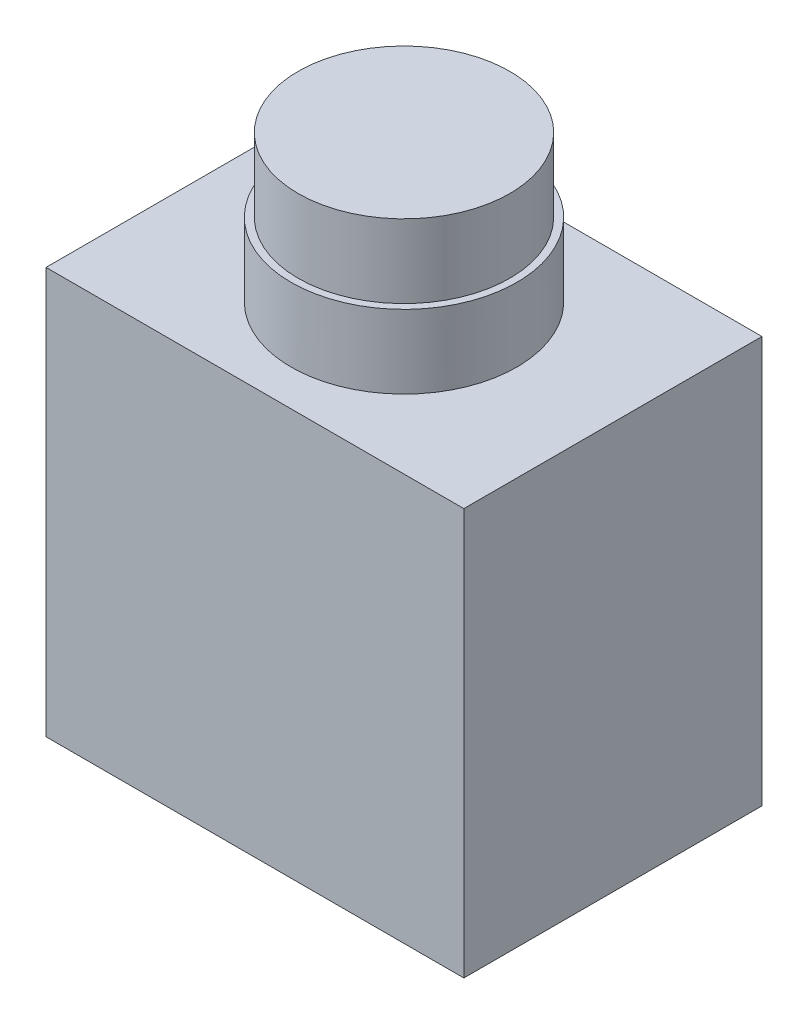
from build123d import *

# Parameters (mm, degrees)
SKETCH1_W           = 23.495
SKETCH1_H           = 16.764
BOSS_EXTRUDE1_DEPTH = 22.86
SKETCH2_R           = 6.35
BOSS_EXTRUDE2_DEPTH = 4.1275
SKETCH3_R           = 5.953125
BOSS_EXTRUDE3_DEPTH = 4.1275


with BuildPart() as part:
    # Sketch1 → Boss-Extrude1 (new body)
    with BuildSketch(Plane(origin=(0, 0, 0), x_dir=(1, 0, 0), z_dir=(0, 1, 0))):
        with Locations((11.7475, 8.382)):
            Rectangle(SKETCH1_W, SKETCH1_H)
    extrude(amount=BOSS_EXTRUDE1_DEPTH)

    # Sketch2 → Boss-Extrude2 (add)
    with BuildSketch(Plane(origin=(0, 22.86, 0), x_dir=(1, 0, 0), z_dir=(0, 1, 0))):
        with Locations(Location((11.7475, 8.382, 0), (0, 0, 90))):
            Circle(SKETCH2_R)
    extrude(amount=BOSS_EXTRUDE2_DEPTH)

    # Sketch3 → Boss-Extrude3 (add)
    with BuildSketch(Plane(origin=(0, 26.9875, 0), x_dir=(1, 0, 0), z_dir=(0, 1, 0))):
        with Locations(Location((11.7475, 8.382, 0), (0, 0, 270))):
            Circle(SKETCH3_R)
    extrude(amount=BOSS_EXTRUDE3_DEPTH)


solid = part.part
